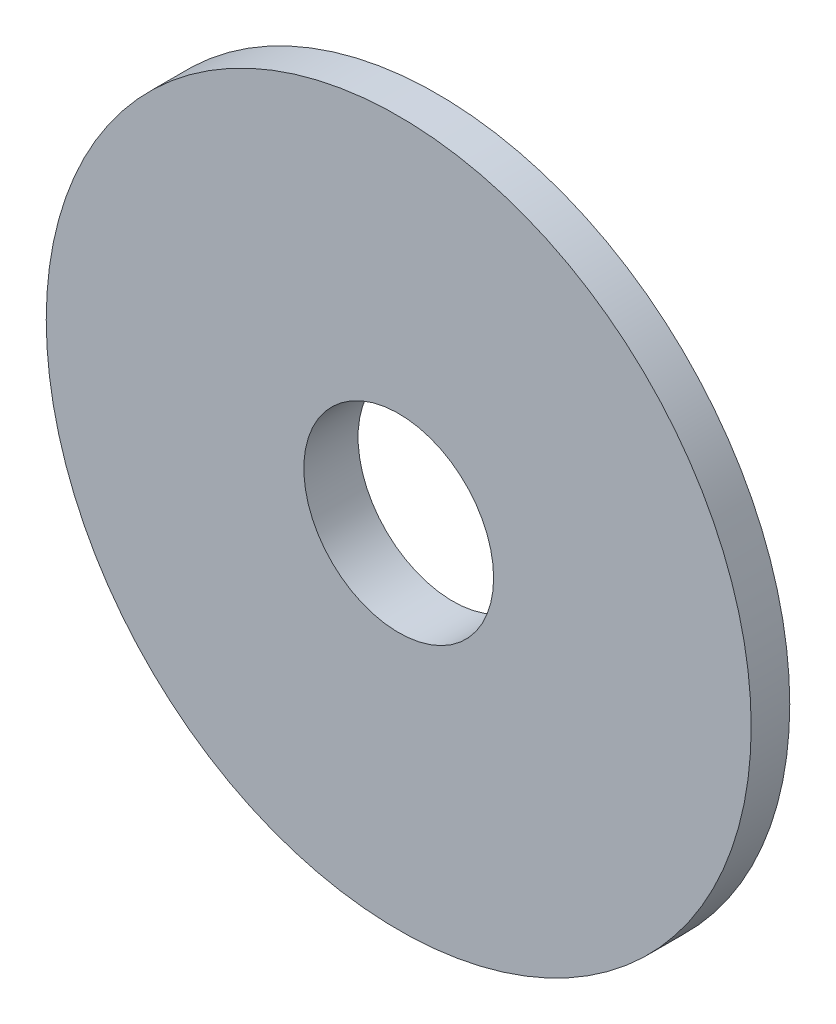
from build123d import *

# Parameters (mm, degrees)
SKETCH1_R           = 13
SKETCH1_R_2         = 3.5
BOSS_EXTRUDE1_DEPTH = 2
CHAMFER1_SIZE       = 1
CHAMFER1_SIZE2      = 0.577350269


with BuildPart() as part:
    # Sketch1 → Boss-Extrude1 (new body)
    with BuildSketch(Plane.XY):
        Circle(SKETCH1_R)
        Circle(SKETCH1_R_2, mode=Mode.SUBTRACT)
    extrude(amount=BOSS_EXTRUDE1_DEPTH)

    # Chamfer1
    chamfer1_edges = [part.edges().sort_by_distance(p)[0] for p in [
        (-13, 0, 0),
    ]]
    chamfer1_side = [part.faces().sort_by_distance(p)[0] for p in [
        (-12.632304474, 0, 0),
    ]]
    chamfer(chamfer1_edges, length=CHAMFER1_SIZE, length2=CHAMFER1_SIZE2, reference=chamfer1_side[0])


solid = part.part
